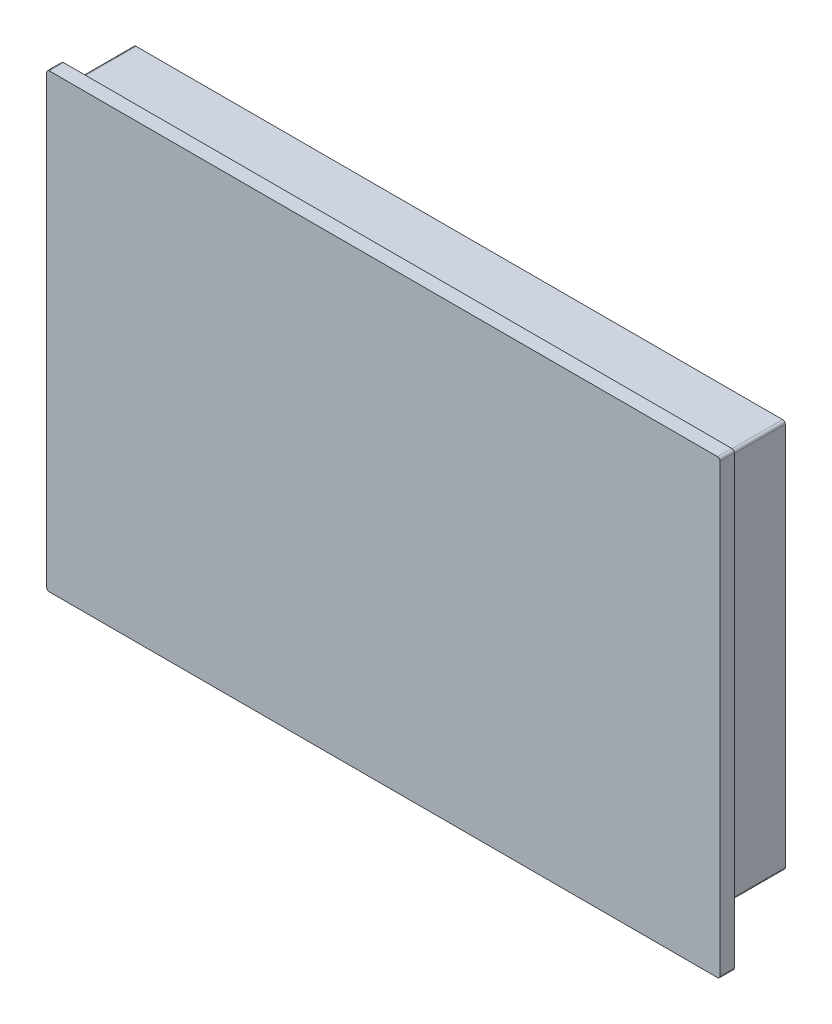
from build123d import *

# Parameters (mm, degrees)
SKETCH1_W            = 127.6
SKETCH1_H            = 85.5
BOSS_EXTRUDE1_DEPTH  = 14.4
SKETCH2_W            = 127.6
SKETCH2_H            = 85.5
SKETCH2_W_2          = 123.5
SKETCH2_H_2          = 81.2
CUT_EXTRUDE1_DEPTH   = 11.7
FILLET1_R            = 0.5
SKETCH3_R            = 3.4
CUT_EXTRUDE2_DEPTH   = 9.8
LPATTERN2_COUNT      = 8
LPATTERN2_PITCH      = 9
LPATTERN2_COUNT_DIR2 = 12
LPATTERN2_PITCH_DIR2 = 9
CUT_EXTRUDE3_DEPTH   = 11.7
FILLET2_R            = 0.5


with BuildPart() as part:
    # Sketch1 → Boss-Extrude1 (new body)
    with BuildSketch(Plane.XY):
        Rectangle(SKETCH1_W, SKETCH1_H)
    extrude(amount=BOSS_EXTRUDE1_DEPTH)

    # Sketch2 → Cut-Extrude1 (cut)
    with BuildSketch(Plane(origin=(0, 0, 0), x_dir=(-1, 0, 0), z_dir=(0, 0, -1))):
        Rectangle(SKETCH2_W, SKETCH2_H)
        Rectangle(SKETCH2_W_2, SKETCH2_H_2, mode=Mode.SUBTRACT)
    extrude(amount=-CUT_EXTRUDE1_DEPTH, mode=Mode.SUBTRACT)

    # Fillet1
    fillet1_edges = [part.edges().sort_by_distance(p)[0] for p in [
        (-61.75, -40.6, 5.85),
        (61.75, -40.6, 5.85),
        (61.75, 40.6, 5.85),
        (-61.75, 40.6, 5.85),
        (63.8, -42.75, 13.05),
        (-63.8, -42.75, 13.05),
        (-63.8, 42.75, 13.05),
        (63.8, 42.75, 13.05),
    ]]
    fillet(fillet1_edges, radius=FILLET1_R)

    # Sketch3 → Cut-Extrude2 (cut)
    with BuildSketch(Plane(origin=(0, 0, 0), x_dir=(-1, 0, 0), z_dir=(0, 0, -1))):
        with Locations((-49.4, 31.35)):
            Circle(SKETCH3_R)
    cut_extrude2 = extrude(amount=-CUT_EXTRUDE2_DEPTH, mode=Mode.SUBTRACT)

    # LPattern2: Cut-Extrude2 8 × 12
    with Locations(*[(-j * LPATTERN2_PITCH_DIR2, -i * LPATTERN2_PITCH, 0) for i in range(LPATTERN2_COUNT) for j in range(LPATTERN2_COUNT_DIR2) if (i, j) != (0, 0)]):
        add(cut_extrude2, mode=Mode.SUBTRACT)

    # Sketch4 → Cut-Extrude3 (cut)
    with BuildSketch(Plane(origin=(0, 0, 0), x_dir=(-1, 0, 0), z_dir=(0, 0, -1))):
        Polygon((-64.33792147, -30.250790597), (-51.805815692, -42.782896374), (-64.33792147, -42.782896374), align=None)
        Polygon((64.33792147, -42.782896374), (64.33792147, -30.250790597), (51.805815692, -42.782896374), align=None)
    extrude(amount=-CUT_EXTRUDE3_DEPTH, mode=Mode.SUBTRACT)

    # Fillet2
    fillet2_edges = [part.edges().sort_by_distance(p)[0] for p in [
        (53.988712066, -40.6, 5.85),
        (61.75, -32.838712066, 5.85),
        (-61.75, -32.838712066, 5.85),
        (-53.988712066, -40.6, 5.85),
    ]]
    fillet(fillet2_edges, radius=FILLET2_R)


solid = part.part
